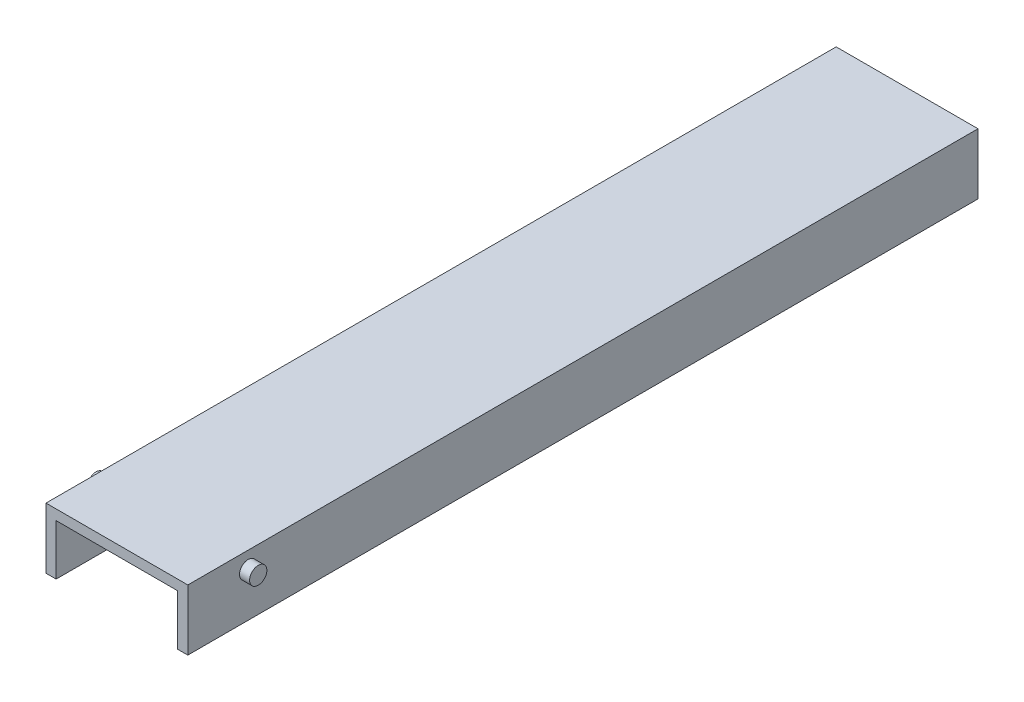
from build123d import *

# Parameters (mm, degrees)
SKETCH1_W           = 35
SKETCH1_H           = 195
BOSS_EXTRUDE1_DEPTH = 15
BOSS_EXTRUDE2_DEPTH = 2.5
BOSS_EXTRUDE3_START = 2.5
SKETCH3_R           = 2.125
BOSS_EXTRUDE3_DEPTH = 2.5
SKETCH4_W           = 30
SKETCH4_H           = 25
CUT_EXTRUDE1_DEPTH  = 260.5
SKETCH5_W           = 10.625
SKETCH5_H           = 15
CUT_EXTRUDE2_DEPTH  = 65
BOSS_EXTRUDE4_DEPTH = 10.625


with BuildPart() as part:
    # Sketch1 → Boss-Extrude1 (new body)
    with BuildSketch(Plane(origin=(0, 0, 0), x_dir=(1, 0, 0), z_dir=(0, 1, 0))):
        Rectangle(SKETCH1_W, SKETCH1_H)
    extrude(amount=BOSS_EXTRUDE1_DEPTH)

    # Sketch2 → Boss-Extrude2 (add)
    with BuildSketch(Plane.ZY.offset(17.5)):
        with BuildLine():
            ThreePointArc((95.375, 10.875), (94.75260191, 12.37760191), (93.25, 13))
            ThreePointArc((93.25, 13), (91.125, 10.875), (93.25, 8.75))
            ThreePointArc((93.25, 8.75), (94.75260191, 9.37239809), (95.375, 10.875))
        make_face()
    extrude(amount=BOSS_EXTRUDE2_DEPTH)

    # Sketch3 → Boss-Extrude3 (add)
    with BuildSketch(Plane(origin=(17.5, 0, 0), x_dir=(0, 0, -1), z_dir=(1, 0, 0)).offset(BOSS_EXTRUDE3_START)):
        with Locations((-93.25, 10.875)):
            Circle(SKETCH3_R)
    extrude(amount=-BOSS_EXTRUDE3_DEPTH)

    # Sketch4 → Cut-Extrude1 (cut)
    with BuildSketch(Plane.XY.offset(97.5)):
        Rectangle(SKETCH4_W, SKETCH4_H)
    extrude(amount=-CUT_EXTRUDE1_DEPTH, mode=Mode.SUBTRACT)

    # Sketch5 → Cut-Extrude2 (cut)
    with BuildSketch(Plane.ZY.offset(17.5)):
        with Locations((-92.1875, 7.5)):
            Rectangle(SKETCH5_W, SKETCH5_H)
    extrude(amount=-CUT_EXTRUDE2_DEPTH, mode=Mode.SUBTRACT)

    # Sketch6 → Boss-Extrude4 (add)
    with BuildSketch(Plane.XY.offset(97.5)):
        Polygon((-17.5, 15), (17.5, 15), (17.5, 0), (15, 0), (15, 12.5), (-15, 12.5), (-15, 0), (-17.5, 0), align=None)
    extrude(amount=BOSS_EXTRUDE4_DEPTH)


solid = part.part
